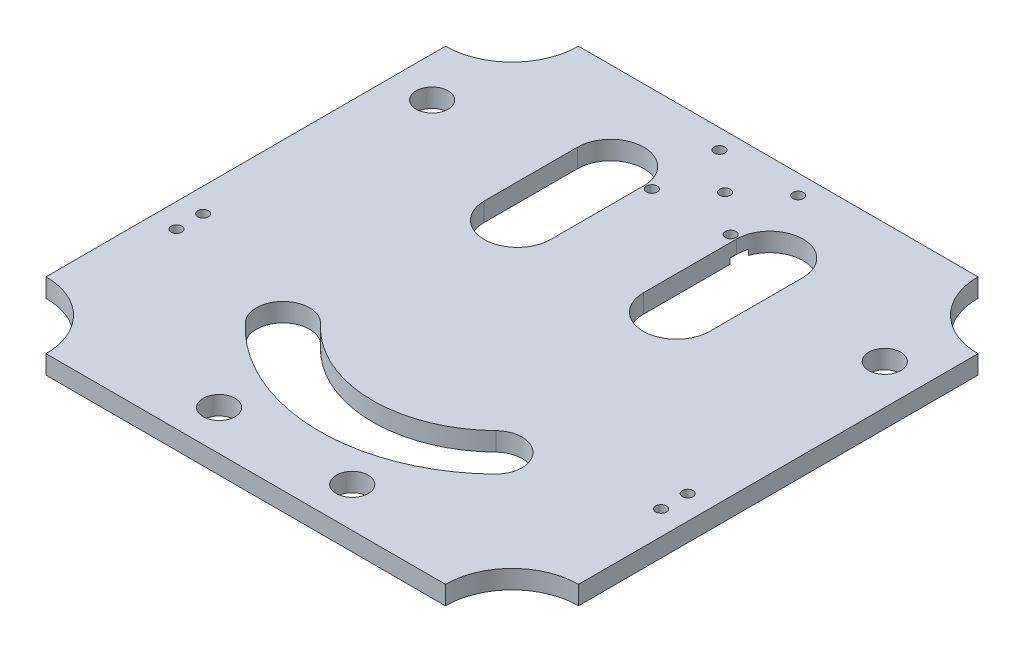
from build123d import *

# Parameters (mm, degrees)
SKETCH1_R           = 6
BOSS_EXTRUDE2_DEPTH = 7
SKETCH2_R           = 2
CUT_EXTRUDE1_DEPTH  = 142.594491418
SKETCH3_R           = 2
CUT_EXTRUDE3_DEPTH  = 142.594491418
SKETCH4_R           = 2
CUT_EXTRUDE4_DEPTH  = 142.594491418
SKETCH5_W           = 36
SKETCH5_H           = 31
CUT_EXTRUDE7_DEPTH  = 2


with BuildPart() as part:
    # Sketch1 → Boss-Extrude2 (new body)
    with BuildSketch(Plane(origin=(0, 0, 0), x_dir=(1, 0, 0), z_dir=(0, 1, 0))):
        with BuildLine():
            Line((-75, 100), (75, 100))
            ThreePointArc((75, 100), (82.32233047, 82.32233047), (100, 75))
            Line((100, 75), (100, -75))
            ThreePointArc((100, -75), (82.32233047, -82.32233047), (75, -100))
            Line((75, -100), (-75, -100))
            ThreePointArc((-75, -100), (-82.32233047, -82.32233047), (-100, -75))
            Line((-100, -75), (-100, 75))
            ThreePointArc((-100, 75), (-82.32233047, 82.32233047), (-75, 100))
        make_face()
        with Locations(Location((-85, 55, 0), (0, 0, 270))):
            Circle(SKETCH1_R, mode=Mode.SUBTRACT)
        with Locations(Location((85, 55, 0), (0, 0, 270))):
            Circle(SKETCH1_R, mode=Mode.SUBTRACT)
        with Locations(Location((25, -85, 0), (0, 0, 270))):
            Circle(SKETCH1_R, mode=Mode.SUBTRACT)
        with Locations(Location((-25, -85, 0), (0, 0, 270))):
            Circle(SKETCH1_R, mode=Mode.SUBTRACT)
        with BuildLine():
            Line((-17.370892019, 66.924882629), (-17.370892019, 31.924882629))
            ThreePointArc((-17.370892019, 31.924882629), (-29.870892019, 19.424882629), (-42.370892019, 31.924882629))
            Line((-42.370892019, 31.924882629), (-42.370892019, 66.924882629))
            ThreePointArc((-42.370892019, 66.924882629), (-29.870892019, 79.424882629), (-17.370892019, 66.924882629))
        make_face(mode=Mode.SUBTRACT)
        with BuildLine():
            Line((17.370892019, 66.924882629), (17.370892019, 31.924882629))
            ThreePointArc((17.370892019, 31.924882629), (29.870892019, 19.424882629), (42.370892019, 31.924882629))
            Line((42.370892019, 31.924882629), (42.370892019, 66.924882629))
            ThreePointArc((42.370892019, 66.924882629), (29.870892019, 79.424882629), (17.370892019, 66.924882629))
        make_face(mode=Mode.SUBTRACT)
        with BuildLine():
            ThreePointArc((-47.767999672, -52.36655043), (-0.196924647, -73.88254423), (48.43804341, -54.893467096))
            ThreePointArc((48.43804341, -54.893467096), (48.645377153, -40.752851384), (34.504761441, -40.545517641))
            ThreePointArc((34.504761441, -40.545517641), (0.328207745, -53.889439519), (-33.100731657, -38.769813727))
            ThreePointArc((-33.100731657, -38.769813727), (-47.232734016, -38.234548071), (-47.767999672, -52.36655043))
        make_face(mode=Mode.SUBTRACT)
    extrude(amount=BOSS_EXTRUDE2_DEPTH)

    # Sketch2 → Cut-Extrude1 (cut, through all)
    with BuildSketch(Plane(origin=(0, 7, 0), x_dir=(1, 0, 0), z_dir=(0, 1, 0))):
        with Locations(Location((-91, -25, 0), (0, 0, 270))):
            Circle(SKETCH2_R)
        with Locations(Location((0, 80, 0), (0, 0, 270))):
            Circle(SKETCH2_R)
        with Locations(Location((91, -25, 0), (0, 0, 270))):
            Circle(SKETCH2_R)
    extrude(amount=-CUT_EXTRUDE1_DEPTH, mode=Mode.SUBTRACT)

    # Sketch3 → Cut-Extrude3 (cut, through all)
    with BuildSketch(Plane(origin=(0, 7, 0), x_dir=(1, 0, 0), z_dir=(0, 1, 0))):
        with Locations(Location((-91, -35, 0), (0, 0, 270))):
            Circle(SKETCH3_R)
        with Locations(Location((91, -35, 0), (0, 0, 270))):
            Circle(SKETCH3_R)
    extrude(amount=-CUT_EXTRUDE3_DEPTH, mode=Mode.SUBTRACT)

    # Sketch4 → Cut-Extrude4 (cut, through all)
    with BuildSketch(Plane(origin=(0, 7, 0), x_dir=(1, 0, 0), z_dir=(0, 1, 0))):
        with Locations(Location((-14.796, 67.317, 0), (0, 0, 270))):
            Circle(SKETCH4_R)
        with Locations(Location((-14.796, 92.683, 0), (0, 0, 270))):
            Circle(SKETCH4_R)
        with Locations(Location((14.796833333, 92.683, 0), (0, 0, 270))):
            Circle(SKETCH4_R)
        with Locations(Location((14.796833333, 67.317, 0), (0, 0, 270))):
            Circle(SKETCH4_R)
    extrude(amount=-CUT_EXTRUDE4_DEPTH, mode=Mode.SUBTRACT)

    # Sketch5 → Cut-Extrude7 (cut)
    with BuildSketch(Plane.XZ):
        with Locations((0, -80)):
            Rectangle(SKETCH5_W, SKETCH5_H)
    extrude(amount=-CUT_EXTRUDE7_DEPTH, mode=Mode.SUBTRACT)


solid = part.part
